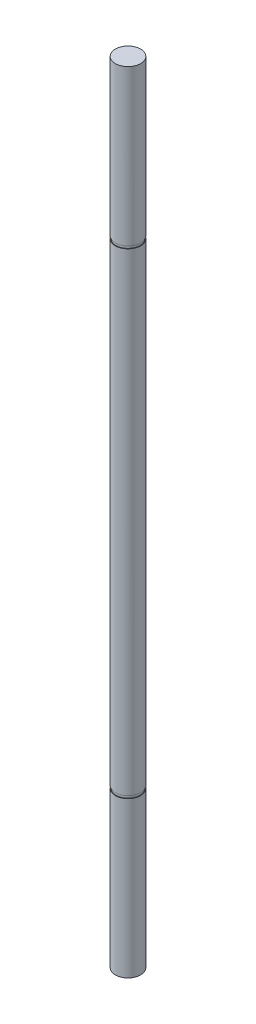
from build123d import *

# Parameters (mm, degrees)
SKETCH_1_R      = 4
EXTRUDE_1_DEPTH = 125
SKETCH_3_W      = 5
SKETCH_3_H      = 0.8


with BuildPart() as part:
    # 草图1 → 凸台-拉伸1 (new, symmetric)
    with BuildSketch(Plane(origin=(0, 0, 0), x_dir=(1, 0, 0), z_dir=(0, 1, 0))):
        with Locations(Location((0, 0, 0), (0, 0, 270))):
            Circle(SKETCH_1_R)
    extrude(amount=EXTRUDE_1_DEPTH, both=True)

    # 草图3 → 切除-旋转1 (revolve, cut)
    with BuildSketch(Plane(origin=(0, 0, 0), x_dir=(0, 0, -1), z_dir=(1, 0, 0)), mode=Mode.PRIVATE) as cut_revolve_1_sk:
        with Locations((6.3, 75.4)):
            Rectangle(SKETCH_3_W, SKETCH_3_H)
    cut_revolve_1 = revolve(cut_revolve_1_sk.sketch.rotate(Axis((0, 125, 0), (0, -1, 0)), 180), axis=Axis((0, 125, 0), (0, -1, 0)), mode=Mode.SUBTRACT)

    # 镜向1: 切除-旋转1 across plane
    add(cut_revolve_1.mirror(Plane.ZX), mode=Mode.SUBTRACT)


solid = part.part
